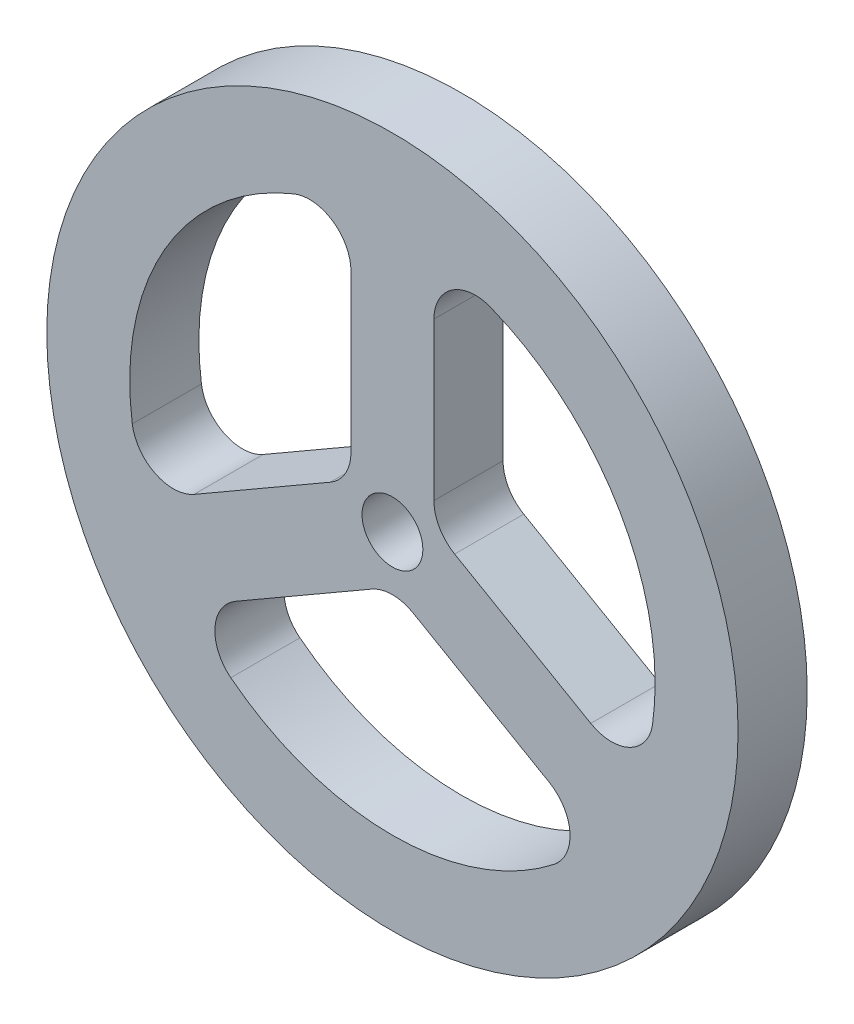
from build123d import *

# Parameters (mm, degrees)
SKETCH1_R           = 31.75
SKETCH1_R_2         = 2.794
BOSS_EXTRUDE3_DEPTH = 6.35
FILLET1_R           = 3.81


with BuildPart() as part:
    # Sketch1 → Boss-Extrude3 (new body)
    with BuildSketch(Plane.XY):
        Circle(SKETCH1_R)
        with BuildLine():
            Line((-18.730057548, -15.213212818), (0, -4.399409051))
            Line((0, -4.399409051), (18.730057548, -15.213212818))
            ThreePointArc((18.730057548, -15.213212818), (0, -24.13), (-18.730057548, -15.213212818))
        make_face(mode=Mode.SUBTRACT)
        with BuildLine():
            Line((-3.81, 23.82731206), (-3.81, 2.199704526))
            Line((-3.81, 2.199704526), (-22.540057548, -8.614099242))
            ThreePointArc((-22.540057548, -8.614099242), (-20.897192993, 12.065), (-3.81, 23.82731206))
        make_face(mode=Mode.SUBTRACT)
        Circle(SKETCH1_R_2, mode=Mode.SUBTRACT)
        with BuildLine():
            Line((22.540057548, -8.614099242), (3.81, 2.199704526))
            Line((3.81, 2.199704526), (3.81, 23.82731206))
            ThreePointArc((3.81, 23.82731206), (20.897192993, 12.065), (22.540057548, -8.614099242))
        make_face(mode=Mode.SUBTRACT)
    extrude(amount=BOSS_EXTRUDE3_DEPTH)

    # Fillet1
    fillet1_edges = [part.edges().sort_by_distance(p)[0] for p in [
        (18.730057548, -15.213212818, 3.175),
        (0, -4.399409051, 3.175),
        (-18.730057548, -15.213212818, 3.175),
        (3.81, 23.82731206, 3.175),
        (3.81, 2.199704526, 3.175),
        (22.540057548, -8.614099242, 3.175),
        (-22.540057548, -8.614099242, 3.175),
        (-3.81, 2.199704526, 3.175),
        (-3.81, 23.82731206, 3.175),
    ]]
    fillet(fillet1_edges, radius=FILLET1_R)


solid = part.part
